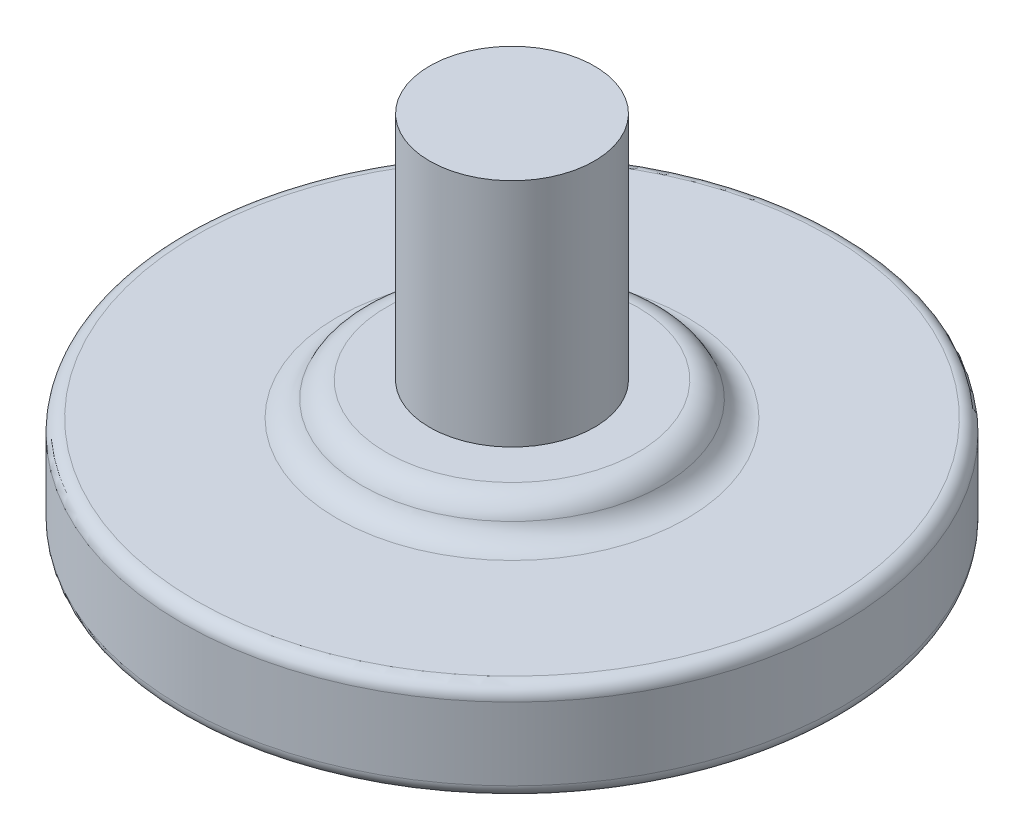
from build123d import *

# Parameters (mm, degrees)
SKETCH1_R           = 10
BOSS_EXTRUDE1_DEPTH = 3
SKETCH2_R           = 2.5
BOSS_EXTRUDE2_DEPTH = 8
FILLET2_R           = 0.4
SKETCH3_R           = 4.5
SKETCH3_R_2         = 2.5
BOSS_EXTRUDE3_DEPTH = 1
FILLET3_R           = 0.8
FILLET4_R           = 0.8


with BuildPart() as part:
    # Sketch1 → Boss-Extrude1 (new body)
    with BuildSketch(Plane(origin=(0, 0, 0), x_dir=(1, 0, 0), z_dir=(0, 1, 0))):
        with Locations(Location((0, 0, 0), (0, 0, 270))):
            Circle(SKETCH1_R)
    extrude(amount=BOSS_EXTRUDE1_DEPTH)

    # Sketch2 → Boss-Extrude2 (add)
    with BuildSketch(Plane(origin=(0, 3, 0), x_dir=(1, 0, 0), z_dir=(0, 1, 0))):
        with Locations(Location((0, 0, 0), (0, 0, 270))):
            Circle(SKETCH2_R)
    extrude(amount=BOSS_EXTRUDE2_DEPTH)

    # Fillet2
    fillet2_edges = [part.edges().sort_by_distance(p)[0] for p in [
        (0, 0, -10),
        (0, 3, -10),
    ]]
    fillet(fillet2_edges, radius=FILLET2_R)

    # Sketch3 → Boss-Extrude3 (add)
    with BuildSketch(Plane(origin=(0, 3, 0), x_dir=(1, 0, 0), z_dir=(0, 1, 0))):
        with Locations(Location((0, 0, 0), (0, 0, 270))):
            Circle(SKETCH3_R)
        with Locations(Location((0, 0, 0), (0, 0, 270))):
            Circle(SKETCH3_R_2, mode=Mode.SUBTRACT)
    extrude(amount=BOSS_EXTRUDE3_DEPTH)

    # Fillet3
    fillet3_edges = [part.edges().sort_by_distance(p)[0] for p in [
        (0, 3, -4.5),
    ]]
    fillet(fillet3_edges, radius=FILLET3_R)

    # Fillet4
    fillet4_edges = [part.edges().sort_by_distance(p)[0] for p in [
        (0, 4, -4.5),
    ]]
    fillet(fillet4_edges, radius=FILLET4_R)


solid = part.part
